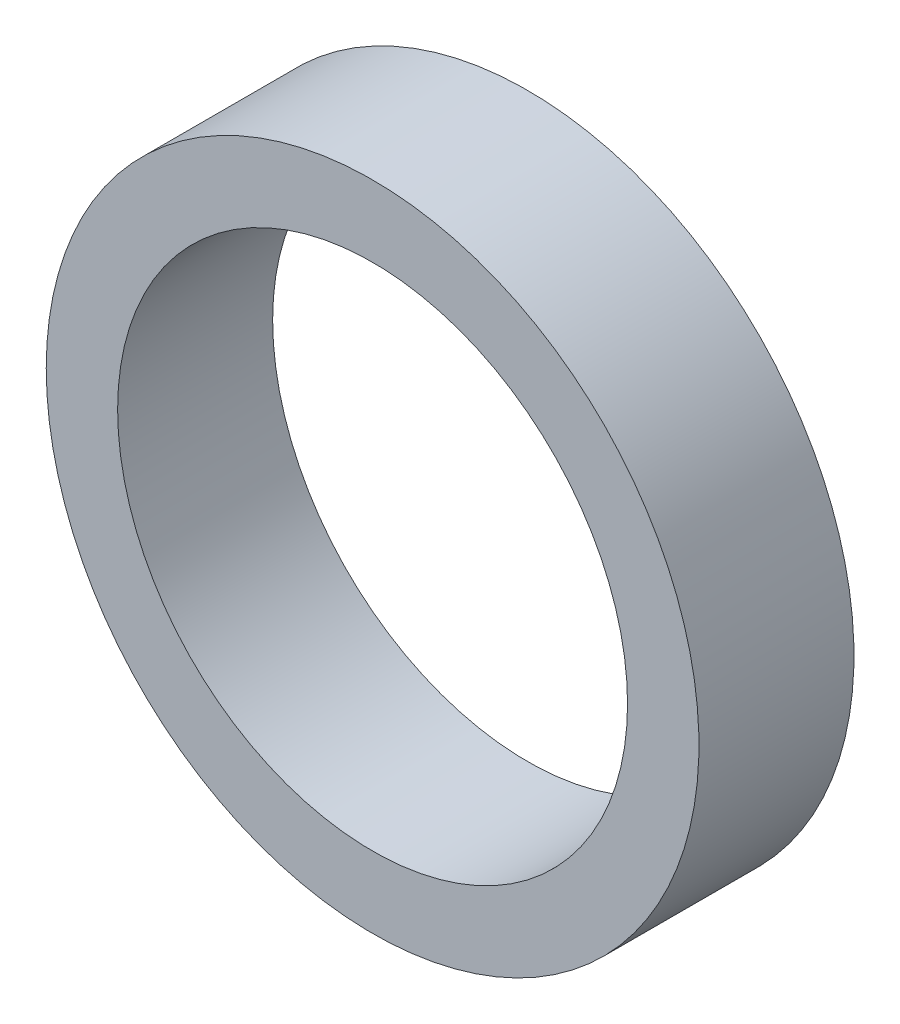
from build123d import *

# Parameters (mm, degrees)
SKETCH1_R           = 16
SKETCH1_R_2         = 12.5
BOSS_EXTRUDE1_DEPTH = 7.6


with BuildPart() as part:
    # Sketch1 → Boss-Extrude1 (new body)
    with BuildSketch(Plane.XY):
        with Locations(Location((0, 0, 0), (0, 0, 180))):
            Circle(SKETCH1_R)
        with Locations(Location((0, 0, 0), (0, 0, 180))):
            Circle(SKETCH1_R_2, mode=Mode.SUBTRACT)
    extrude(amount=BOSS_EXTRUDE1_DEPTH)


solid = part.part
